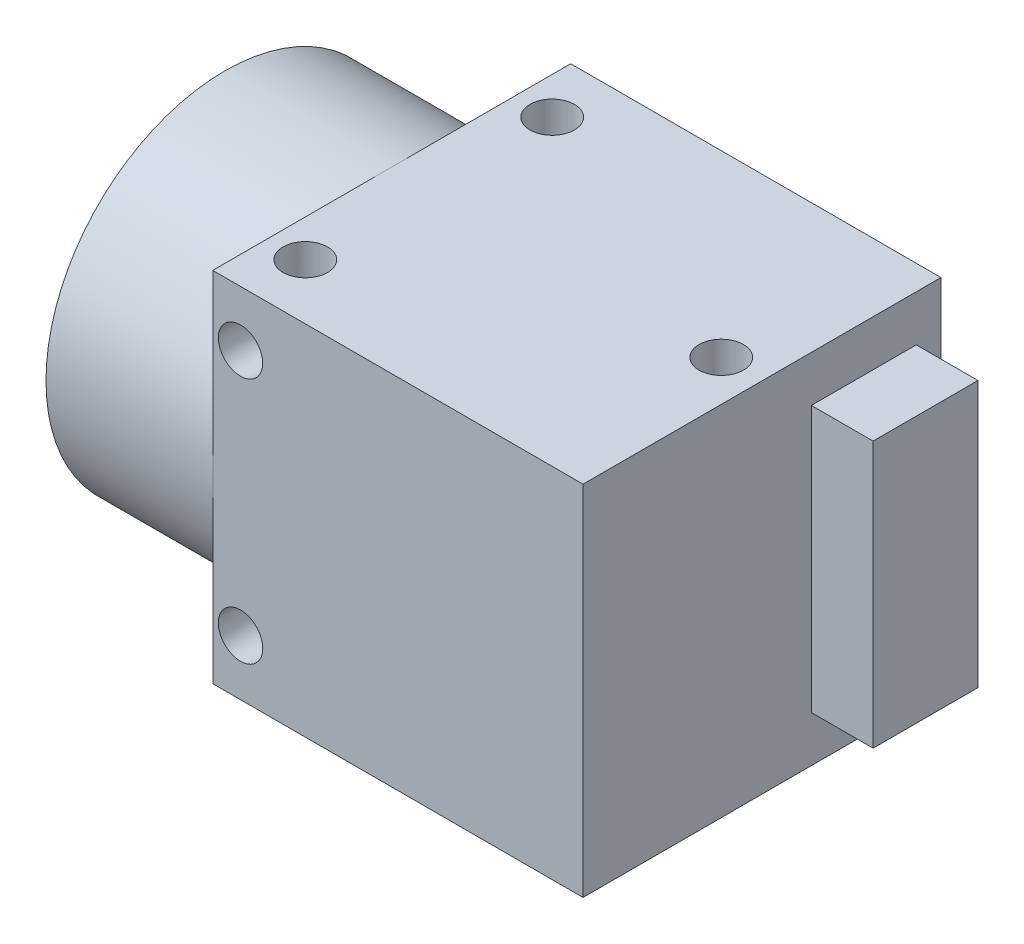
from build123d import *

# Parameters (mm, degrees)
SKETCH1_W                = 29
SKETCH1_H                = 29
BOSS_EXTRUDE1_DEPTH      = 48.51
CUT_EXTRUDE1_DEPTH       = 13.51
M3_CLEARANCE_HOLE3_D     = 3.6
M3_CLEARANCE_HOLE3_DEPTH = 3
M3_CLEARANCE_HOLE3_TIP   = 1.081549114
SKETCH6_W                = 29
SKETCH6_H                = 29
SKETCH6_W_2              = 8.5
SKETCH6_H_2              = 21.55
CUT_EXTRUDE2_DEPTH       = 5
M3_CLEARANCE_HOLE2_D     = 3.6
M3_CLEARANCE_HOLE2_DEPTH = 3
M3_CLEARANCE_HOLE2_TIP   = 1.081549114


with BuildPart() as part:
    # Sketch1 → Boss-Extrude1 (new body)
    with BuildSketch(Plane(origin=(0, 0, 0), x_dir=(0, -1, 0), z_dir=(1, 0, 0))):
        with Locations((14.5, 14.5)):
            Rectangle(SKETCH1_W, SKETCH1_H)
    extrude(amount=BOSS_EXTRUDE1_DEPTH)

    # Sketch2 → Cut-Extrude1 (cut)
    with BuildSketch(Plane.ZY):
        with BuildLine():
            Line((-14.500000026, 0), (-29, 0))
            Line((-29, 0), (-24.753048327, -4.246951673))
            ThreePointArc((-24.753048327, -4.246951673), (-20.048909781, -1.103746784), (-14.500000026, 0))
        make_face()
        with BuildLine():
            Line((-24.753048327, -4.246951673), (-29, 0))
            Line((-29, 0), (-29, -14.499999948))
            ThreePointArc((-29, -14.499999948), (-27.896253211, -8.951090207), (-24.753048327, -4.246951673))
        make_face()
        with BuildLine():
            ThreePointArc((-14.5, -29), (-24.753048346, -24.753048309), (-29, -14.499999948))
            Line((-29, -14.499999948), (-29, -29))
            Line((-29, -29), (-14.5, -29))
        make_face()
        with BuildLine():
            Line((0, -29), (-4.246951673, -24.753048327))
            ThreePointArc((-4.246951673, -24.753048327), (-8.951090231, -27.896253221), (-14.5, -29))
            Line((-14.5, -29), (0, -29))
        make_face()
        with BuildLine():
            ThreePointArc((0, -14.5), (-1.103746779, -20.048909769), (-4.246951673, -24.753048327))
            Line((-4.246951673, -24.753048327), (0, -29))
            Line((0, -29), (0, -14.5))
        make_face()
        with BuildLine():
            Line((0, 0), (-14.500000026, 0))
            ThreePointArc((-14.500000026, 0), (-4.246951682, -4.246951664), (0, -14.5))
            Line((0, -14.5), (0, 0))
        make_face()
    extrude(amount=-CUT_EXTRUDE1_DEPTH, mode=Mode.SUBTRACT)

    # M3 Clearance Hole3
    with Locations(Plane.XY):
        with Locations((15.76, -24.5), (15.76, -4.5)):
            Hole(M3_CLEARANCE_HOLE3_D / 2, depth=M3_CLEARANCE_HOLE3_DEPTH)
            with Locations((0, 0, -(M3_CLEARANCE_HOLE3_DEPTH + M3_CLEARANCE_HOLE3_TIP / 2))):  # 118° drill point
                Cone(0, M3_CLEARANCE_HOLE3_D / 2, M3_CLEARANCE_HOLE3_TIP, mode=Mode.SUBTRACT)

    # Sketch6 → Cut-Extrude2 (cut)
    with BuildSketch(Plane(origin=(48.51, 0, 0), x_dir=(0, 0, -1), z_dir=(1, 0, 0))):
        with Locations((14.5, -14.5)):
            Rectangle(SKETCH6_W, SKETCH6_H)
        with Locations((22.75, -14.5)):
            Rectangle(SKETCH6_W_2, SKETCH6_H_2, mode=Mode.SUBTRACT)
    extrude(amount=-CUT_EXTRUDE2_DEPTH, mode=Mode.SUBTRACT)

    # M3 Clearance Hole2
    with Locations(Plane(origin=(0, 0, 0), x_dir=(1, 0, 0), z_dir=(0, 1, 0))):
        with Locations((16.51, 24.5), (16.51, 4.5), (40.21, 14.5)):
            Hole(M3_CLEARANCE_HOLE2_D / 2, depth=M3_CLEARANCE_HOLE2_DEPTH)
            with Locations((0, 0, -(M3_CLEARANCE_HOLE2_DEPTH + M3_CLEARANCE_HOLE2_TIP / 2))):  # 118° drill point
                Cone(0, M3_CLEARANCE_HOLE2_D / 2, M3_CLEARANCE_HOLE2_TIP, mode=Mode.SUBTRACT)


solid = part.part
